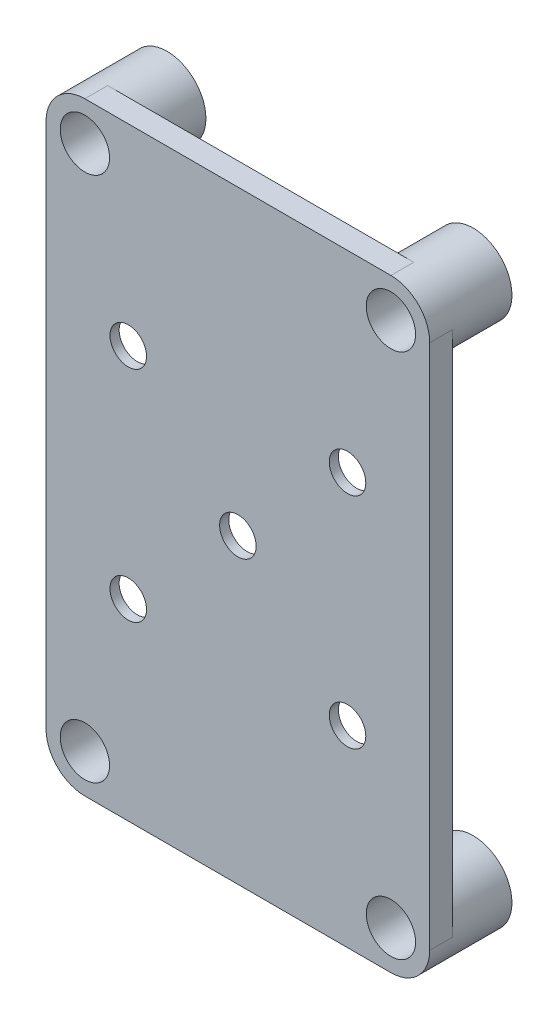
from build123d import *
from OCP.BRepFilletAPI import BRepFilletAPI_MakeChamfer
from build123d.topology import SkipClean

# Parameters (mm, degrees)
SKETCH_1_R      = 2
SKETCH_1_R_2    = 2.7
EXTRUDE_1_DEPTH = 2.5
EXTRUDE_START   = -6.5
SKETCH_1_3_R    = 4.25
SKETCH_1_3_R_2  = 2.7
EXTRUDE_2_DEPTH = 6.5
CHAMFER_1_SIZE  = 2.3
CHAMFER_1_SIZE2 = 1.5
CHAMFER_2_SIZE  = 1.5
CHAMFER_2_SIZE2 = 2.3


with BuildPart() as part:
    # 草图1 → 凸台-拉伸1 (new body)
    with BuildSketch(Plane.XY):
        with BuildLine():
            ThreePointArc((-16.75, 33.05), (-19.75520382, 31.80520382), (-21, 28.8))
            Line((-21, 28.8), (-21, -28.8))
            ThreePointArc((-21, -28.8), (-19.75520382, -31.80520382), (-16.75, -33.05))
            Line((-16.75, -33.05), (16.75, -33.05))
            ThreePointArc((16.75, -33.05), (19.75520382, -31.80520382), (21, -28.8))
            Line((21, -28.8), (21, 28.8))
            ThreePointArc((21, 28.8), (19.75520382, 31.80520382), (16.75, 33.05))
            Line((16.75, 33.05), (-16.75, 33.05))
        make_face()
        with Locations((-12, 12)):
            Circle(SKETCH_1_R, mode=Mode.SUBTRACT)
        with Locations((12, 12)):
            Circle(SKETCH_1_R, mode=Mode.SUBTRACT)
        with Locations((12, -12)):
            Circle(SKETCH_1_R, mode=Mode.SUBTRACT)
        with Locations((-12, -12)):
            Circle(SKETCH_1_R, mode=Mode.SUBTRACT)
        Circle(SKETCH_1_R, mode=Mode.SUBTRACT)
        with Locations((-16.75, 28.8)):
            Circle(SKETCH_1_R_2, mode=Mode.SUBTRACT)
        with Locations((16.75, 28.8)):
            Circle(SKETCH_1_R_2, mode=Mode.SUBTRACT)
        with Locations((16.75, -28.8)):
            Circle(SKETCH_1_R_2, mode=Mode.SUBTRACT)
        with Locations((-16.75, -28.8)):
            Circle(SKETCH_1_R_2, mode=Mode.SUBTRACT)
    extrude(amount=EXTRUDE_1_DEPTH)

    # 草图1<3> → 凸台-拉伸2 (add)
    # profile 1 of 4: a face of its own
    with SkipClean():  # the faces are left unmerged after this step: merging them gives an invalid solid
        with BuildSketch(Plane.XY.offset(EXTRUDE_START)):
            with Locations((-16.75, 28.8)):
                Circle(SKETCH_1_3_R)
            with Locations((-16.75, 28.8)):
                Circle(SKETCH_1_3_R_2, mode=Mode.SUBTRACT)
        # profile 2 of 4: a face of its own
        with BuildSketch(Plane.XY.offset(EXTRUDE_START)):
            with Locations((-16.75, -28.8)):
                Circle(SKETCH_1_3_R)
            with Locations((-16.75, -28.8)):
                Circle(SKETCH_1_3_R_2, mode=Mode.SUBTRACT)
        # profile 3 of 4: a face of its own
        with BuildSketch(Plane.XY.offset(EXTRUDE_START)):
            with Locations((16.75, 28.8)):
                Circle(SKETCH_1_3_R)
            with Locations((16.75, 28.8)):
                Circle(SKETCH_1_3_R_2, mode=Mode.SUBTRACT)
        # profile 4 of 4: a face of its own
        with BuildSketch(Plane.XY.offset(EXTRUDE_START)):
            with Locations((16.75, -28.8)):
                Circle(SKETCH_1_3_R)
            with Locations((16.75, -28.8)):
                Circle(SKETCH_1_3_R_2, mode=Mode.SUBTRACT)
        extrude(amount=EXTRUDE_2_DEPTH)

    # 倒角1
    chamfer_1_edges = [part.edges().sort_by_distance(p)[0] for p in [
        (10, -12, 0),
        (-14, 12, 0),
    ]]
    chamfer_1_side = [part.faces().sort_by_distance(p)[0] for p in [
        (0, 32.266851866, 0),
    ]]
    chamfer(chamfer_1_edges, length=CHAMFER_1_SIZE, length2=CHAMFER_1_SIZE2, reference=chamfer_1_side[0])

    # 倒角2: one chamfer whose edges measure the first distance from different faces: ONE call of the kernel's chamfer builder (chamfer() names one face for all edges)
    chamfer_2_edges_1 = [part.edges().sort_by_distance(p)[0] for p in [
        (10, 12, 0),
    ]]
    chamfer_2_side_1 = [part.faces().sort_by_distance(p)[0] for p in [
        (10, 12, 1.25),
    ]]
    chamfer_2_edges_2 = [part.edges().sort_by_distance(p)[0] for p in [
        (-2, 0, 0),
    ]]
    chamfer_2_side_2 = [part.faces().sort_by_distance(p)[0] for p in [
        (-2, 0, 1.25),
    ]]
    chamfer_2_edges_3 = [part.edges().sort_by_distance(p)[0] for p in [
        (-14, -12, 0),
    ]]
    chamfer_2_side_3 = [part.faces().sort_by_distance(p)[0] for p in [
        (-14, -12, 1.25),
    ]]
    chamfer_2 = BRepFilletAPI_MakeChamfer(part.part.solid().wrapped)
    for e in chamfer_2_edges_1:
        chamfer_2.Add(CHAMFER_2_SIZE, CHAMFER_2_SIZE2, e.wrapped, chamfer_2_side_1[0].wrapped)  # the first distance lies on this face
    for e in chamfer_2_edges_2:
        chamfer_2.Add(CHAMFER_2_SIZE, CHAMFER_2_SIZE2, e.wrapped, chamfer_2_side_2[0].wrapped)  # the first distance lies on this face
    for e in chamfer_2_edges_3:
        chamfer_2.Add(CHAMFER_2_SIZE, CHAMFER_2_SIZE2, e.wrapped, chamfer_2_side_3[0].wrapped)  # the first distance lies on this face
    add(Compound.cast(chamfer_2.Shape()), mode=Mode.REPLACE)


solid = part.part
